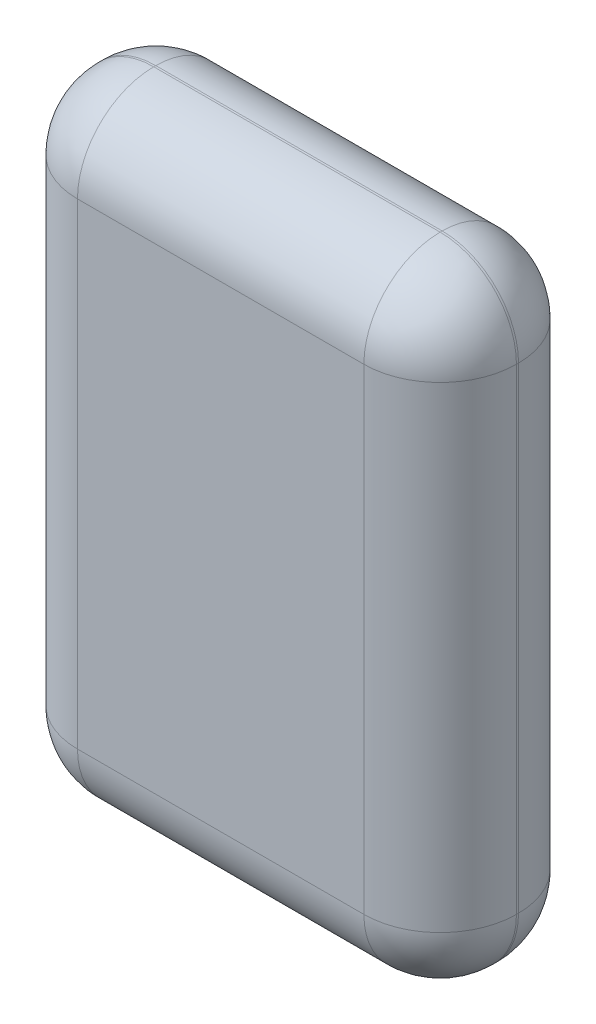
from build123d import *

# Parameters (mm, degrees)
SKETCH1_W           = 63.3
SKETCH1_H           = 90.7
BOSS_EXTRUDE1_DEPTH = 11.15
FILLET1_R           = 11


with BuildPart() as part:
    # Sketch1 → Boss-Extrude1 (new, symmetric)
    with BuildSketch(Plane.XY):
        Rectangle(SKETCH1_W, SKETCH1_H)
    extrude(amount=BOSS_EXTRUDE1_DEPTH, both=True)

    # Fillet1
    fillet1_edges = [part.edges().sort_by_distance(p)[0] for p in [
        (-31.65, 0, 11.15),
        (0, -45.35, 11.15),
        (31.65, 0, 11.15),
        (0, -45.35, -11.15),
        (-31.65, 0, -11.15),
        (0, 45.35, -11.15),
        (31.65, 0, -11.15),
        (31.65, -45.35, 0),
        (-31.65, -45.35, 0),
        (-31.65, 45.35, 0),
        (31.65, 45.35, 0),
        (0, 45.35, 11.15),
    ]]
    fillet(fillet1_edges, radius=FILLET1_R)


solid = part.part
